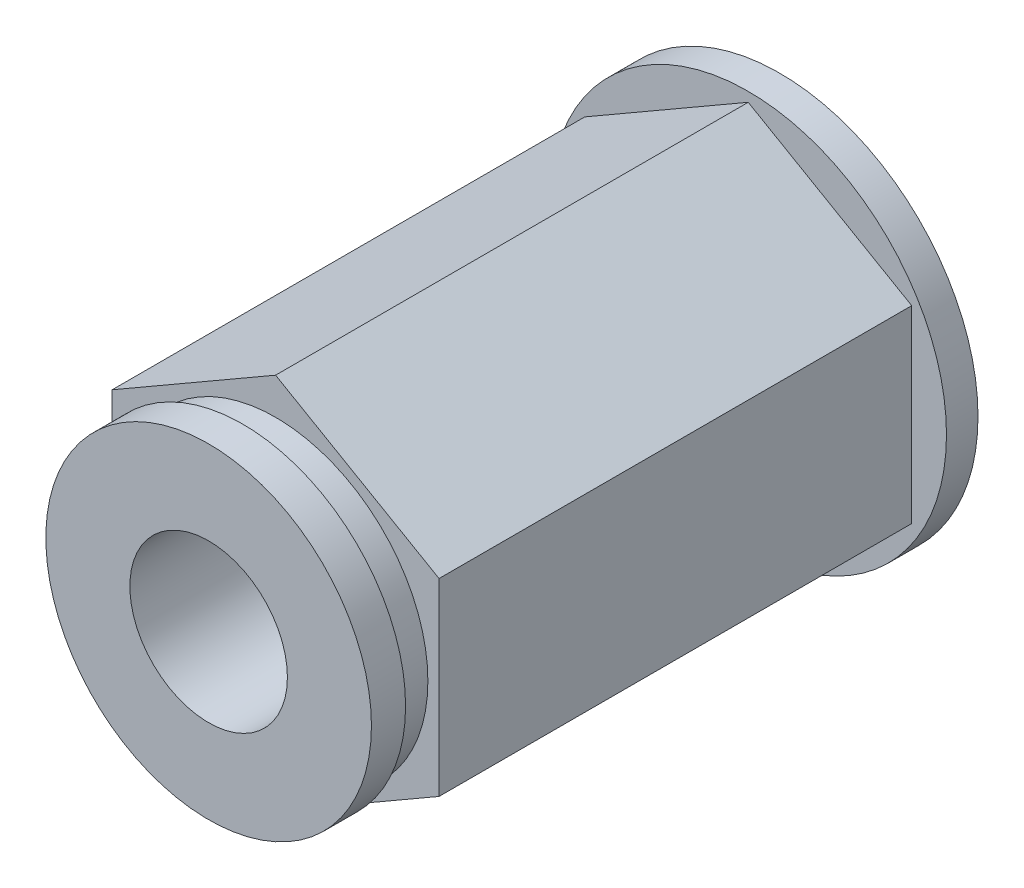
from build123d import *

# Parameters (mm, degrees)
ESQUISSE1_R             = 7.55
BOSS_EXTRU_1_DEPTH      = 1.2
BOSS_EXTRU_2_DEPTH      = 18
ESQUISSE3_R             = 5.8
BOSS_EXTRU_3_DEPTH      = 1.25
ESQUISSE4_R             = 6.2
BOSS_EXTRU_4_DEPTH      = 1.3
ESQUISSE5_R             = 3
ENL_V_MAT_EXTRU_1_DEPTH = 25.229475851


with BuildPart() as part:
    # Esquisse1 → Boss.-Extru.1 (new body)
    with BuildSketch(Plane.XY):
        Circle(ESQUISSE1_R)
    extrude(amount=BOSS_EXTRU_1_DEPTH)

    # Esquisse2 → Boss.-Extru.2 (add)
    with BuildSketch(Plane.XY.offset(1.2)):
        Polygon((6.225, -3.594005426), (6.225, 3.594005426), (0, 7.188010851), (-6.225, 3.594005426), (-6.225, -3.594005426), (0, -7.188010851), align=None)
    extrude(amount=BOSS_EXTRU_2_DEPTH)

    # Esquisse3 → Boss.-Extru.3 (add)
    with BuildSketch(Plane.XY.offset(19.2)):
        Circle(ESQUISSE3_R)
    extrude(amount=BOSS_EXTRU_3_DEPTH)

    # Esquisse4 → Boss.-Extru.4 (add)
    with BuildSketch(Plane.XY.offset(20.45)):
        Circle(ESQUISSE4_R)
    extrude(amount=BOSS_EXTRU_4_DEPTH)

    # Esquisse5 → Enlèv. mat.-Extru.1 (cut, through all)
    with BuildSketch(Plane.XY.offset(21.75)):
        Circle(ESQUISSE5_R)
    extrude(amount=-ENL_V_MAT_EXTRU_1_DEPTH, mode=Mode.SUBTRACT)


solid = part.part
